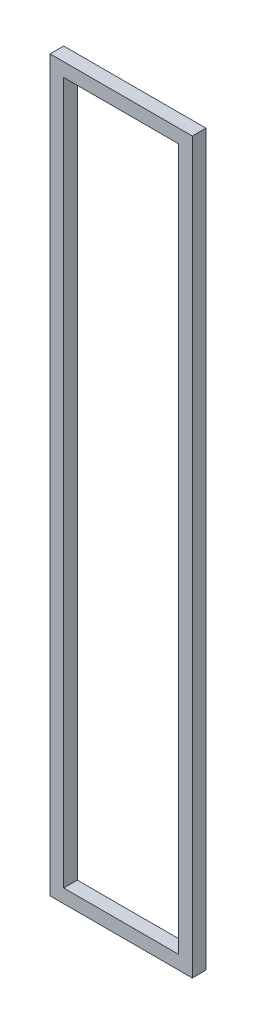
from build123d import *

# Parameters (mm, degrees)
SKETCH1_W      = 265.1252
SKETCH1_H      = 1358.9
SKETCH1_W_2    = 214.3252
SKETCH1_H_2    = 1308.1
EXTRUDE1_DEPTH = 25.4


with BuildPart() as part:
    # Sketch1 → Extrude1 (new body)
    with BuildSketch(Plane.XY):
        with Locations((94.272319654, 645.02143696)):
            Rectangle(SKETCH1_W, SKETCH1_H)
        with Locations((94.272319654, 645.02143696)):
            Rectangle(SKETCH1_W_2, SKETCH1_H_2, mode=Mode.SUBTRACT)
    extrude(amount=EXTRUDE1_DEPTH)


solid = part.part
